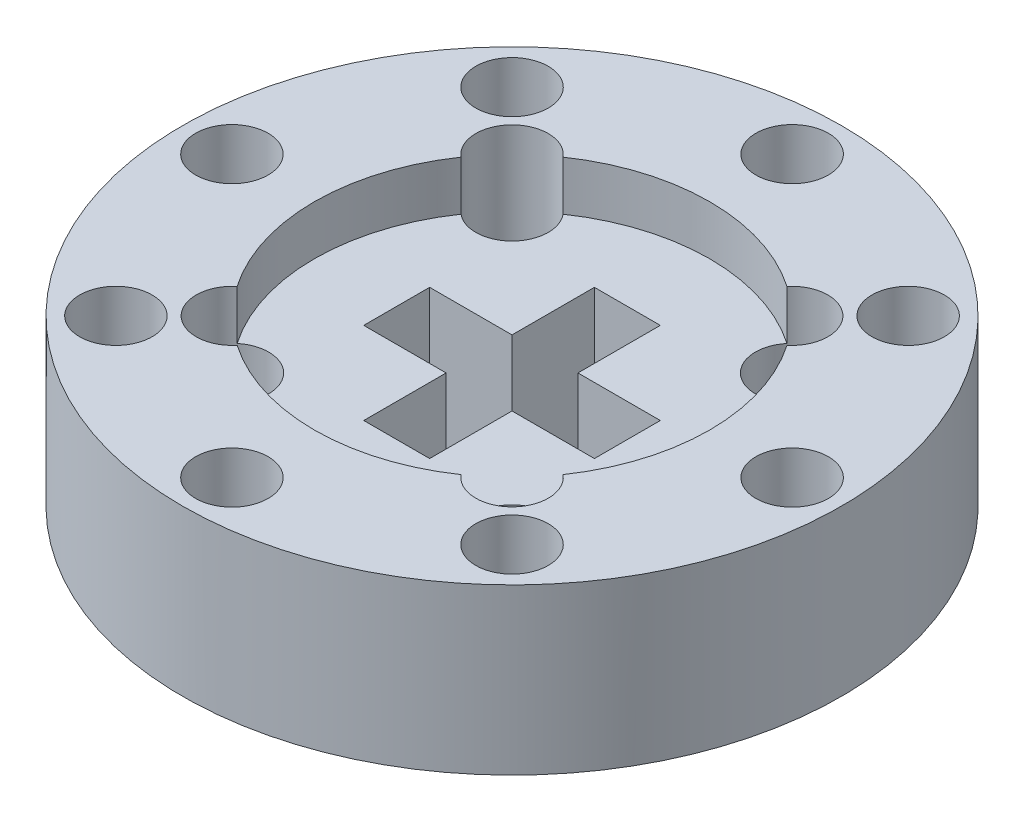
from build123d import *

# Parameters (mm, degrees)
SKETCH_1_R               = 10
EXTRUDE_1_DEPTH          = 7
SKETCH_2_R               = 1.1
CUT_EXTRUDE_1_DEPTH      = 16.779733838
PATTERN_CIRCULAR_1_COUNT = 4
PATTERN_CIRCULAR_1_ANGLE = 135
SKETCH_3_R               = 1.1
CUT_EXTRUDE_2_DEPTH      = 16.779733838
PATTERN_CIRCULAR_2_COUNT = 2
PATTERN_CIRCULAR_2_ANGLE = 90
SKETCH_4_R               = 6
CUT_EXTRUDE_3_DEPTH      = 1.5
SKETCH_5_R               = 10
SKETCH_5_R_2             = 4.5
CUT_EXTRUDE_4_DEPTH      = 2


with BuildPart() as part:
    # 草图1 → 凸台-拉伸1 (new body)
    with BuildSketch(Plane(origin=(0, 0, 0), x_dir=(1, 0, 0), z_dir=(0, 1, 0))):
        with Locations(Location((0, 0, 0), (0, 0, 270))):
            Circle(SKETCH_1_R)
        Polygon((1, 1), (3.5, 1), (3.5, -1), (1, -1), (1, -3.5), (-1, -3.5), (-1, -1), (-3.5, -1), (-3.5, 1), (-1, 1), (-1, 3.5), (1, 3.5), align=None, mode=Mode.SUBTRACT)
    extrude(amount=EXTRUDE_1_DEPTH)

    # 草图2 → 切除-拉伸1 (cut, through all)
    with BuildSketch(Plane(origin=(0, 7, 0), x_dir=(1, 0, 0), z_dir=(0, 1, 0))):
        with Locations(Location((-6.01040764, 6.01040764, 0), (0, 0, 270))):
            Circle(SKETCH_2_R)
        with Locations(Location((6.01040764, -6.01040764, 0), (0, 0, 270))):
            Circle(SKETCH_2_R)
    cut_extrude_1 = extrude(amount=-CUT_EXTRUDE_1_DEPTH, mode=Mode.SUBTRACT)

    # 阵列(圆周)1: 切除-拉伸1 ×4 about axis
    pattern_circular_1_axis = Axis((0, 0, 0), (0, -1, 0))
    for i in range(1, PATTERN_CIRCULAR_1_COUNT):
        add(cut_extrude_1.rotate(pattern_circular_1_axis, i * PATTERN_CIRCULAR_1_ANGLE / (PATTERN_CIRCULAR_1_COUNT - 1)), mode=Mode.SUBTRACT)

    # 草图3 → 切除-拉伸2 (cut, through all)
    with BuildSketch(Plane(origin=(0, 7, 0), x_dir=(1, 0, 0), z_dir=(0, 1, 0))):
        with Locations(Location((-4.242640687, 4.242640687, 0), (0, 0, 270))):
            Circle(SKETCH_3_R)
        with Locations(Location((4.242640687, -4.242640687, 0), (0, 0, 270))):
            Circle(SKETCH_3_R)
    cut_extrude_2 = extrude(amount=-CUT_EXTRUDE_2_DEPTH, mode=Mode.SUBTRACT)

    # 阵列(圆周)2: 切除-拉伸2 ×2 about axis
    pattern_circular_2_axis = Axis((0, 0, 0), (0, 1, 0))
    for i in range(1, PATTERN_CIRCULAR_2_COUNT):
        add(cut_extrude_2.rotate(pattern_circular_2_axis, i * PATTERN_CIRCULAR_2_ANGLE / (PATTERN_CIRCULAR_2_COUNT - 1)), mode=Mode.SUBTRACT)

    # 草图4 → 切除-拉伸3 (cut)
    with BuildSketch(Plane(origin=(0, 7, 0), x_dir=(1, 0, 0), z_dir=(0, 1, 0))):
        Circle(SKETCH_4_R)
    extrude(amount=-CUT_EXTRUDE_3_DEPTH, mode=Mode.SUBTRACT)

    # 草图5 → 切除-拉伸4 (cut)
    with BuildSketch(Plane.XZ):
        with Locations(Location((0, 0, 0), (0, 0, 270))):
            Circle(SKETCH_5_R)
        with Locations(Location((0, 0, 0), (0, 0, 270))):
            Circle(SKETCH_5_R_2, mode=Mode.SUBTRACT)
    extrude(amount=-CUT_EXTRUDE_4_DEPTH, mode=Mode.SUBTRACT)


solid = part.part
